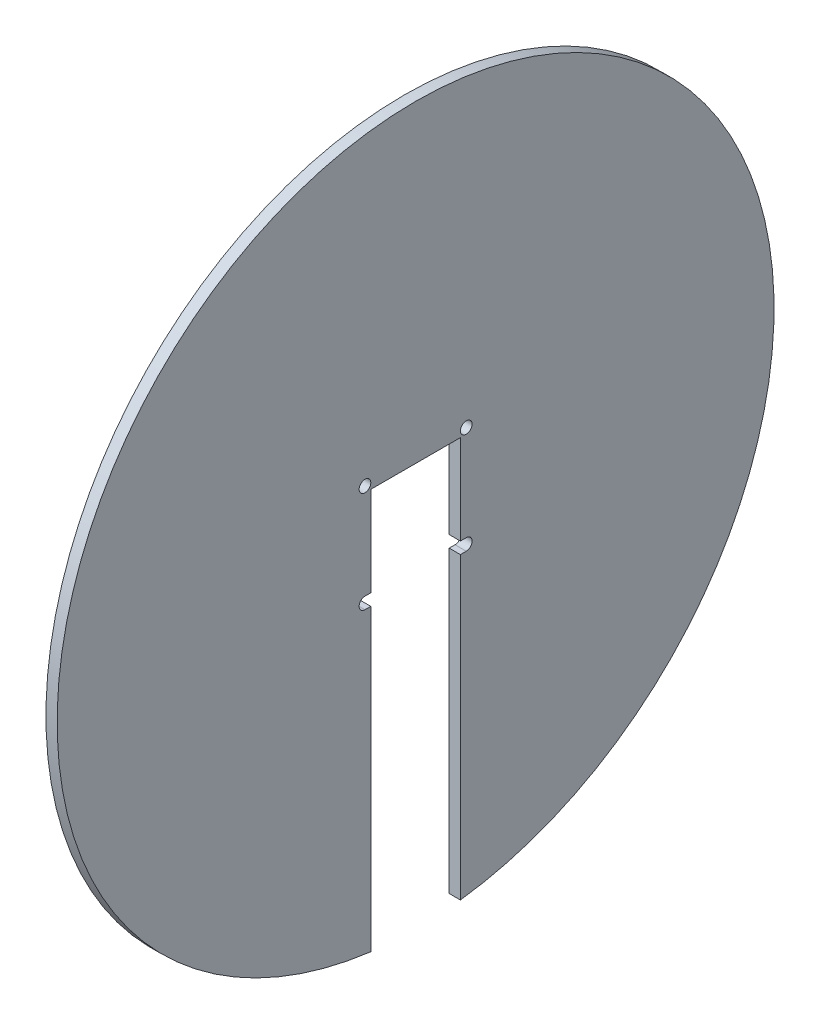
from build123d import *

# Parameters (mm, degrees)
SKETCH1_R           = 1.651
BOSS_EXTRUDE1_DEPTH = 3.175


with BuildPart() as part:
    # Sketch1 → Boss-Extrude1 (new body)
    with BuildSketch(Plane(origin=(0, 0, 0), x_dir=(0, 0, -1), z_dir=(1, 0, 0))):
        with BuildLine():
            Line((-12.7, -12.693314325), (-12.7, 12.7))
            Line((-12.7, 12.7), (12.7, 12.7))
            Line((12.7, 12.7), (12.7, -12.693314325))
            Line((12.7, -12.693314325), (14.351, -12.693314325))
            ThreePointArc((14.351, -12.693314325), (16.008685675, -14.351), (14.351, -16.008685675))
            Line((14.351, -16.008685675), (12.7, -16.008685675))
            Line((12.7, -16.008685675), (12.7, -100.803124952))
            ThreePointArc((12.7, -100.803124952), (0, 101.6), (-12.7, -100.803124952))
            Line((-12.7, -100.803124952), (-12.7, -16.008685675))
            Line((-12.7, -16.008685675), (-14.351, -16.008685675))
            ThreePointArc((-14.351, -16.008685675), (-16.008685675, -14.351), (-14.351, -12.693314325))
            Line((-14.351, -12.693314325), (-12.7, -12.693314325))
        make_face()
        with Locations((-14.351, 14.351)):
            Circle(SKETCH1_R, mode=Mode.SUBTRACT)
        with Locations((14.351, 14.351)):
            Circle(SKETCH1_R, mode=Mode.SUBTRACT)
    extrude(amount=BOSS_EXTRUDE1_DEPTH)


solid = part.part
